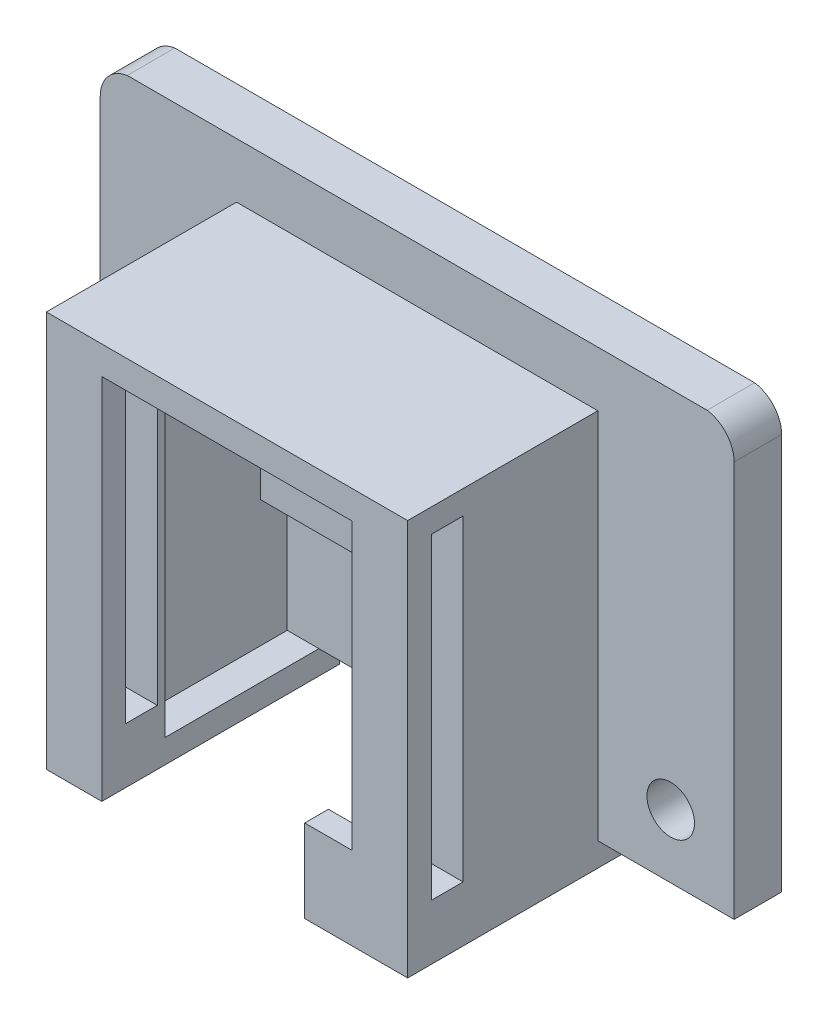
from build123d import *

# Parameters (mm, degrees)
CROQUIS1_R              = 1.5
SALIENTE_EXTRUIR1_DEPTH = 3
SALIENTE_EXTRUIR2_DEPTH = 8
CROQUIS3_W              = 13
CROQUIS3_H              = 1.7
CORTAR_EXTRUIR1_DEPTH   = 8
CROQUIS5_W              = 3.5
CROQUIS5_H              = 11
CROQUIS5_W_2            = 6.5
SALIENTE_EXTRUIR3_DEPTH = 1.5
SALIENTE_EXTRUIR4_DEPTH = 4
CORTAR_EXTRUIR2_START   = -22.8
CROQUIS11_W             = 2
CROQUIS11_H             = 20
CORTAR_EXTRUIR2_DEPTH   = 22.8


with BuildPart() as part:
    # Croquis1 → Saliente-Extruir1 (new body)
    with BuildSketch(Plane.XY):
        with BuildLine():
            Line((-75.306602598, 17.959617496), (-75.306602598, -7.040382504))
            Line((-75.306602598, -7.040382504), (-35.306602598, -7.040382504))
            Line((-35.306602598, -7.040382504), (-35.306602598, 17.959617496))
            ThreePointArc((-35.306602598, 17.959617496), (-35.791122177, 19.26473017), (-37.009921692, 19.937490201))
            Line((-37.009921692, 19.937490201), (-73.603283504, 19.937490201))
            ThreePointArc((-73.603283504, 19.937490201), (-74.822083019, 19.26473017), (-75.306602598, 17.959617496))
        make_face()
        with Locations((-71.306602598, -3.040382504)):
            Circle(CROQUIS1_R, mode=Mode.SUBTRACT)
        with Locations((-39.306602598, -3.040382504)):
            Circle(CROQUIS1_R, mode=Mode.SUBTRACT)
    extrude(amount=SALIENTE_EXTRUIR1_DEPTH)

    # Croquis2 → Saliente-Extruir2 (add)
    with BuildSketch(Plane.XY.offset(3)):
        Polygon((-66.706602598, -7.040382504), (-65.206602598, -7.040382504), (-65.206602598, 14.959617496), (-45.406602598, 14.959617496), (-45.406602598, -7.040382504), (-43.906602598, -7.040382504), (-43.906602598, 16.459617496), (-66.706602598, 16.459617496), align=None)
    extrude(amount=SALIENTE_EXTRUIR2_DEPTH)

    # Croquis3 → Cortar-Extruir1 (cut)
    with BuildSketch(Plane.XZ.offset(7.040382504)):
        with Locations((-58.706602598, 2.15)):
            Rectangle(CROQUIS3_W, CROQUIS3_H)
    extrude(amount=-CORTAR_EXTRUIR1_DEPTH, mode=Mode.SUBTRACT)

    # Croquis5 → Saliente-Extruir3 (add)
    with BuildSketch(Plane.XZ.offset(7.040382504)):
        with Locations((-64.956602598, 5.5)):
            Rectangle(CROQUIS5_W, CROQUIS5_H)
        with Locations((-47.156602598, 5.5)):
            Rectangle(CROQUIS5_W_2, CROQUIS5_H)
    extrude(amount=SALIENTE_EXTRUIR3_DEPTH)

    # Croquis6 → Saliente-Extruir4 (add)
    with BuildSketch(Plane.XY.offset(11)):
        Polygon((-63.206602598, -7.040382504), (-63.206602598, -8.540382504), (-66.706602598, -8.540382504), (-66.706602598, 16.459617496), (-43.906602598, 16.459617496), (-43.906602598, -8.540382504), (-50.406602598, -8.540382504), (-50.406602598, -3.318007663), (-47.406602598, -3.318007663), (-47.406602598, 14.681992337), (-63.206602598, 14.681992337), align=None)
    extrude(amount=SALIENTE_EXTRUIR4_DEPTH)

    # Croquis11 → Cortar-Extruir2 (cut)
    with BuildSketch(Plane.ZY.offset(66.706602598).offset(CORTAR_EXTRUIR2_START)):
        with Locations((12.5, 4.959617496)):
            Rectangle(CROQUIS11_W, CROQUIS11_H)
    extrude(amount=CORTAR_EXTRUIR2_DEPTH, mode=Mode.SUBTRACT)


solid = part.part
